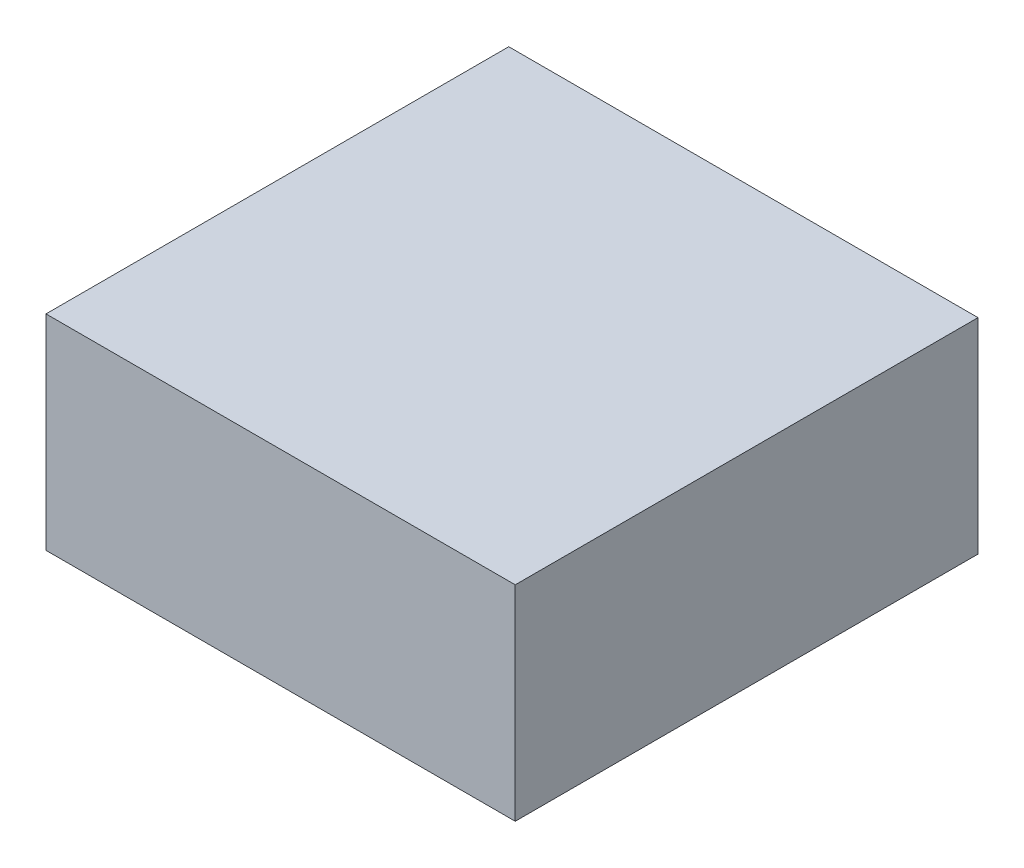
from build123d import *

# Parameters (mm, degrees)
SKETCH1_W           = 362
SKETCH1_H           = 357
BOSS_EXTRUDE1_DEPTH = 158


with BuildPart() as part:
    # Sketch1 → Boss-Extrude1 (new body)
    with BuildSketch(Plane(origin=(0, 0, 0), x_dir=(1, 0, 0), z_dir=(0, 1, 0))):
        Rectangle(SKETCH1_W, SKETCH1_H)
    extrude(amount=BOSS_EXTRUDE1_DEPTH)


solid = part.part
